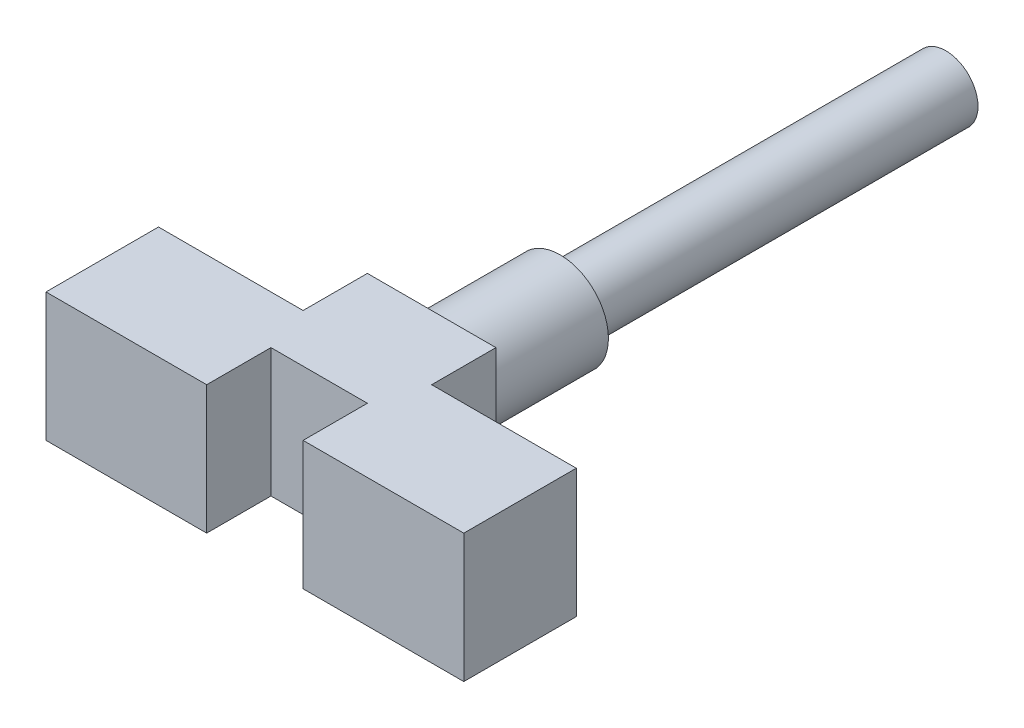
from build123d import *

# Parameters (mm, degrees)
BOSS_EXTRUDE1_DEPTH = 12.7
SKETCH2_R           = 9.525
BOSS_EXTRUDE2_DEPTH = 25.4
SKETCH3_R           = 6.35
BOSS_EXTRUDE3_DEPTH = 76.2


with BuildPart() as part:
    # Sketch1 → Boss-Extrude1 (new, symmetric)
    with BuildSketch(Plane(origin=(0, 0, 0), x_dir=(1, 0, 0), z_dir=(0, 1, 0))):
        Polygon((12.7, 12.7), (-12.7, 12.7), (-12.7, 0), (-41.275, 0), (-41.275, -22.225), (-9.525, -22.225), (-9.525, -9.525), (9.525, -9.525), (9.525, -22.225), (41.275, -22.225), (41.275, 0), (12.7, 0), align=None)
    extrude(amount=BOSS_EXTRUDE1_DEPTH, both=True)

    # Sketch2 → Boss-Extrude2 (add)
    with BuildSketch(Plane(origin=(0, 0, -12.7), x_dir=(-1, 0, 0), z_dir=(0, 0, -1))):
        with Locations(Location((0, 0, 0), (0, 0, 180))):
            Circle(SKETCH2_R)
    extrude(amount=BOSS_EXTRUDE2_DEPTH)

    # Sketch3 → Boss-Extrude3 (add)
    with BuildSketch(Plane(origin=(0, 0, -38.1), x_dir=(-1, 0, 0), z_dir=(0, 0, -1))):
        with Locations(Location((0, 0, 0), (0, 0, 180))):
            Circle(SKETCH3_R)
    extrude(amount=BOSS_EXTRUDE3_DEPTH)


solid = part.part
